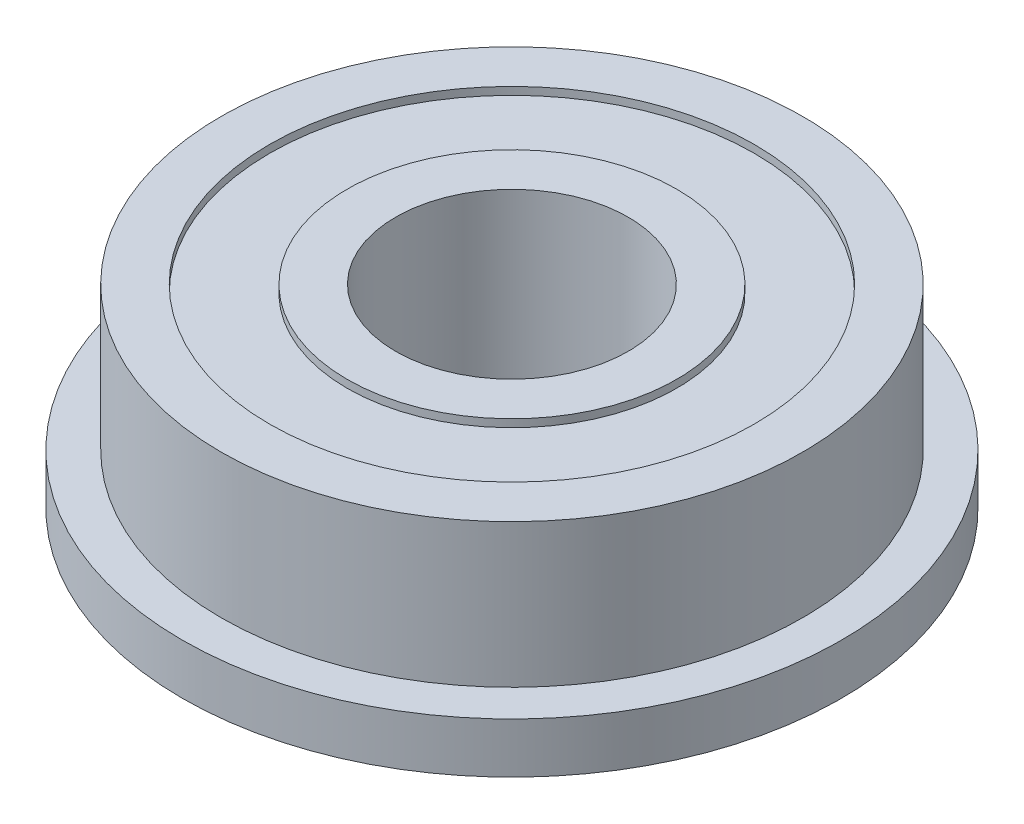
from build123d import *

# Parameters (mm, degrees)
SKETCH_1_R          = 8.5
EXTRUDE_1_DEPTH     = 1.3
SKETCH_2_R          = 7.5
EXTRUDE_2_DEPTH     = 3.7
CUT_EXTRUDE_1_REACH = 15.019
SKETCH_3_R          = 3
SKETCH_4_R          = 6.25
SKETCH_4_R_2        = 4.25
CUT_EXTRUDE_2_DEPTH = 0.2
CUT_EXTRUDE_START   = -0.2
SKETCH_5_R          = 6.25
SKETCH_5_R_2        = 4.25
CUT_EXTRUDE_3_DEPTH = 0.2


with BuildPart() as part:
    # 草图1 → 凸台-拉伸1 (new body)
    with BuildSketch(Plane(origin=(0, 0, 0), x_dir=(1, 0, 0), z_dir=(0, 1, 0))):
        with Locations(Location((0, 0, 0), (0, 0, 270))):
            Circle(SKETCH_1_R)
    extrude(amount=EXTRUDE_1_DEPTH)

    # 草图2 → 凸台-拉伸2 (add)
    with BuildSketch(Plane(origin=(0, 1.3, 0), x_dir=(1, 0, 0), z_dir=(0, 1, 0))):
        with Locations(Location((0, 0, 0), (0, 0, 270))):
            Circle(SKETCH_2_R)
    extrude(amount=EXTRUDE_2_DEPTH)

    # 草图3 → 切除-拉伸1 (cut, up to next)
    with BuildSketch(Plane(origin=(0, 5, 0), x_dir=(1, 0, 0), z_dir=(0, 1, 0)), mode=Mode.PRIVATE) as cut_extrude_1_sk1:
        with Locations(Location((0, 0, 0), (0, 0, 270))):
            Circle(SKETCH_3_R)
    cut_extrude_1_tool1 = extrude(cut_extrude_1_sk1.sketch, amount=-CUT_EXTRUDE_1_REACH, mode=Mode.PRIVATE) & part.part
    add(cut_extrude_1_tool1.solids().sort_by_distance((0, 5, 0))[0], mode=Mode.SUBTRACT)

    # 草图4 → 切除-拉伸2 (cut)
    with BuildSketch(Plane(origin=(0, 5, 0), x_dir=(1, 0, 0), z_dir=(0, 1, 0))):
        with Locations(Location((0, 0, 0), (0, 0, 270))):
            Circle(SKETCH_4_R)
        with Locations(Location((0, 0, 0), (0, 0, 270))):
            Circle(SKETCH_4_R_2, mode=Mode.SUBTRACT)
    extrude(amount=-CUT_EXTRUDE_2_DEPTH, mode=Mode.SUBTRACT)

    # 草图5 → 切除-拉伸3 (cut)
    with BuildSketch(Plane.XZ.offset(CUT_EXTRUDE_START)):
        with Locations(Location((0, 0, 0), (0, 0, 90))):
            Circle(SKETCH_5_R)
        with Locations(Location((0, 0, 0), (0, 0, 90))):
            Circle(SKETCH_5_R_2, mode=Mode.SUBTRACT)
    extrude(amount=CUT_EXTRUDE_3_DEPTH, mode=Mode.SUBTRACT)


solid = part.part
